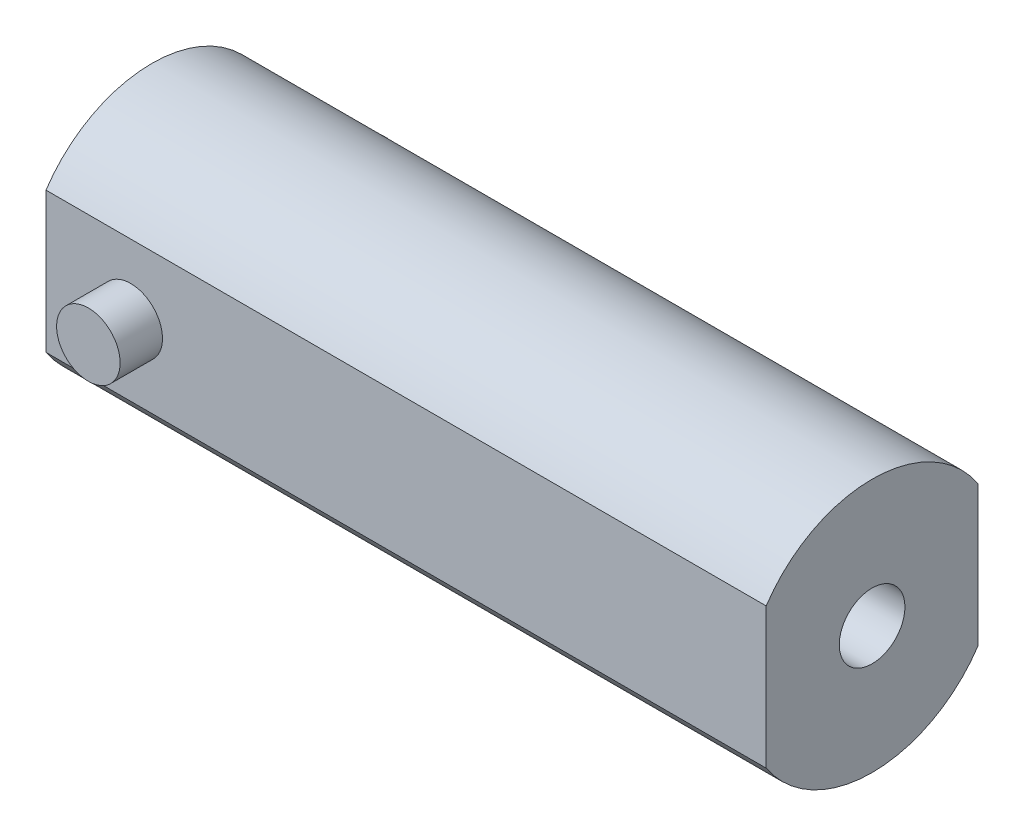
from build123d import *

# Parameters (mm, degrees)
BOSS_EXTRUDE1_DEPTH = 170
SKETCH3_R           = 7.5
BOSS_EXTRUDE2_DEPTH = 10
SKETCH4_R           = 7.75
CUT_EXTRUDE1_DEPTH  = 17


with BuildPart() as part:
    # Sketch1 → Boss-Extrude1 (new body)
    with BuildSketch(Plane(origin=(0, 0, 0), x_dir=(0, 0, -1), z_dir=(1, 0, 0))):
        with BuildLine():
            Line((-25, 16.583123952), (-25, -16.583123952))
            ThreePointArc((-25, -16.583123952), (0, -30), (25, -16.583123952))
            Line((25, -16.583123952), (25, 16.583123952))
            ThreePointArc((25, 16.583123952), (0, 30), (-25, 16.583123952))
        make_face()
    extrude(amount=BOSS_EXTRUDE1_DEPTH)

    # Sketch3 → Boss-Extrude2 (add)
    with BuildSketch(Plane.XY.offset(25)):
        with Locations(Location((20, 0, 0), (0, 0, 180))):
            Circle(SKETCH3_R)
    boss_extrude2 = extrude(amount=BOSS_EXTRUDE2_DEPTH)

    # Mirror1: Boss-Extrude2 across plane
    add(boss_extrude2.mirror(Plane.XY))

    # Sketch4 → Cut-Extrude1 (cut)
    with BuildSketch(Plane(origin=(170, 0, 0), x_dir=(0, 0, -1), z_dir=(1, 0, 0))):
        Circle(SKETCH4_R)
    extrude(amount=-CUT_EXTRUDE1_DEPTH, mode=Mode.SUBTRACT)


solid = part.part
